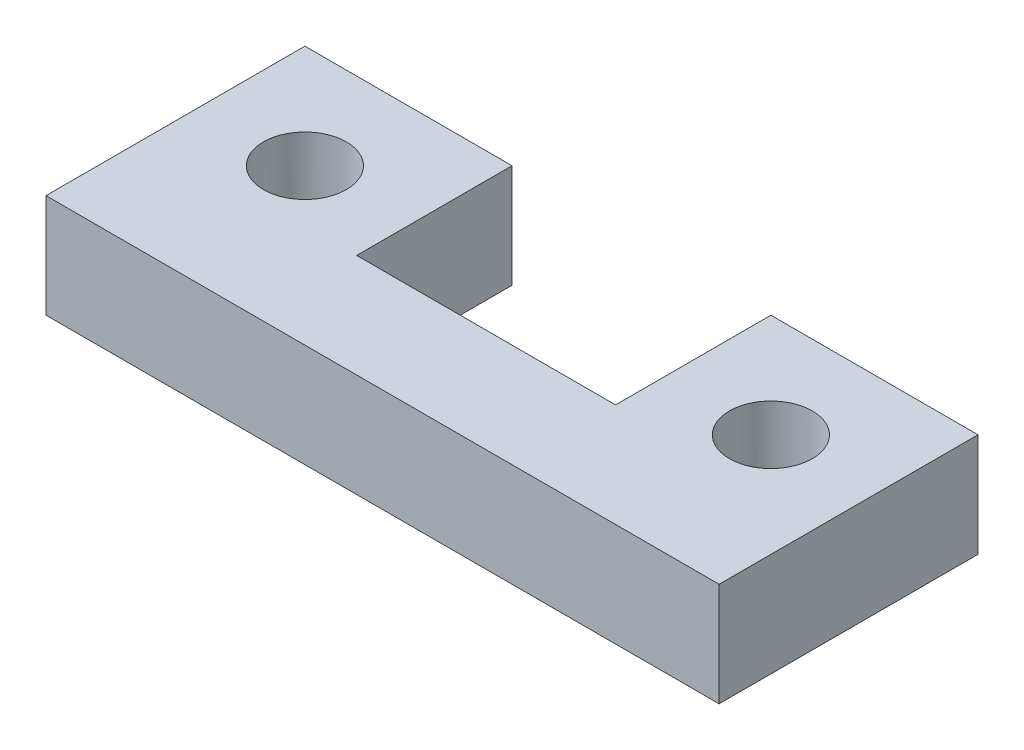
from build123d import *

# Parameters (mm, degrees)
BOSS_EXTRUDE1_DEPTH = 5
SKETCH2_R           = 4
CUT_EXTRUDE1_DEPTH  = 43.20485754


with BuildPart() as part:
    # Sketch1 → Boss-Extrude1 (new, symmetric)
    with BuildSketch(Plane(origin=(0, 0, 0), x_dir=(1, 0, 0), z_dir=(0, 1, 0))):
        Polygon((32.5, 0), (-32.5, 0), (-32.5, 25), (-12.5, 25), (-12.5, 10), (12.5, 10), (12.5, 25), (32.5, 25), align=None)
    extrude(amount=BOSS_EXTRUDE1_DEPTH, both=True)

    # Sketch2 → Cut-Extrude1 (cut, symmetric)
    with BuildSketch(Plane(origin=(0, 5, 0), x_dir=(1, 0, 0), z_dir=(0, 1, 0))):
        with Locations(Location((-22.5, 15, 0), (0, 0, 270))):
            Circle(SKETCH2_R)
    cut_extrude1 = extrude(amount=CUT_EXTRUDE1_DEPTH, both=True, mode=Mode.SUBTRACT)

    # Mirror1: Cut-Extrude1 across plane
    add(cut_extrude1.mirror(Plane(origin=(0, 0, 0), x_dir=(0, 0, 1), z_dir=(1, 0, 0))), mode=Mode.SUBTRACT)


solid = part.part
